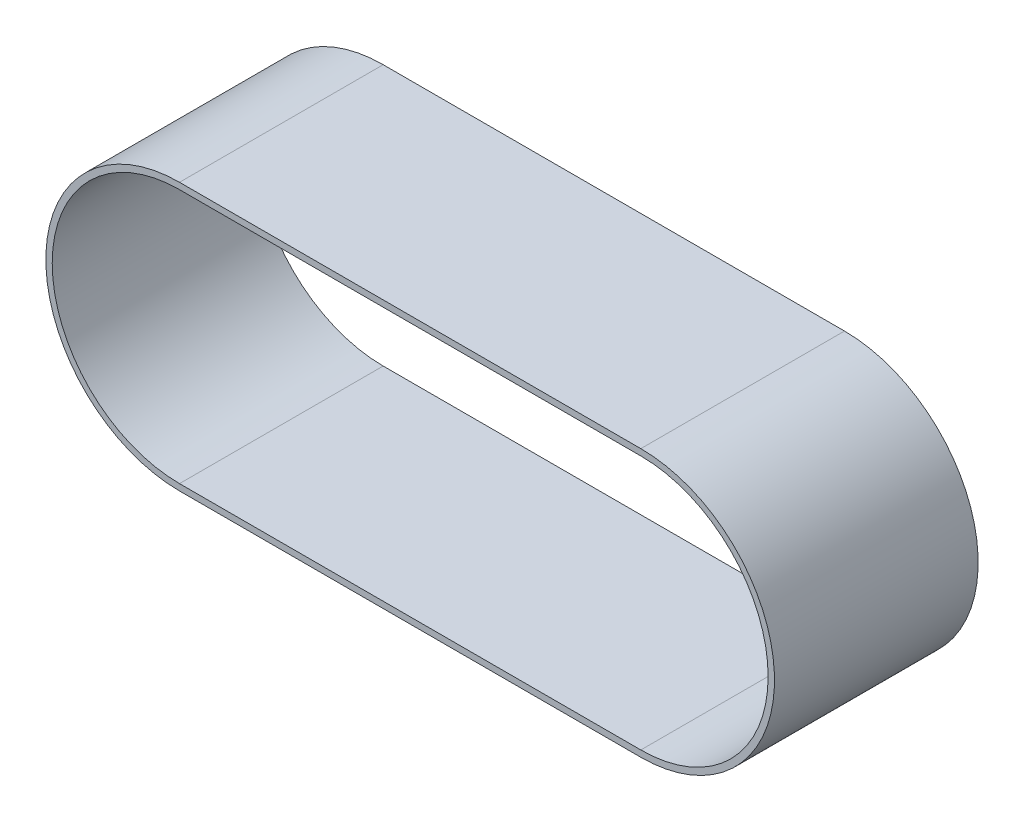
from build123d import *

# Parameters (mm, degrees)
BOSS_EXTRUDE1_DEPTH = 50.8


with BuildPart() as part:
    # Sketch1 → Boss-Extrude1 (new body)
    with BuildSketch(Plane.XY):
        with BuildLine():
            Line((0, 33.3375), (115.062, 33.3375))
            ThreePointArc((115.062, 33.3375), (148.3995, 0), (115.062, -33.3375))
            Line((115.062, -33.3375), (0, -33.3375))
            ThreePointArc((0, -33.3375), (-33.3375, 0), (0, 33.3375))
        make_face()
        with BuildLine():
            Line((0, 31.75), (115.062, 31.75))
            ThreePointArc((115.062, 31.75), (146.812, 0), (115.062, -31.75))
            Line((115.062, -31.75), (0, -31.75))
            ThreePointArc((0, -31.75), (-31.75, 0), (0, 31.75))
        make_face(mode=Mode.SUBTRACT)
    extrude(amount=BOSS_EXTRUDE1_DEPTH)


solid = part.part
